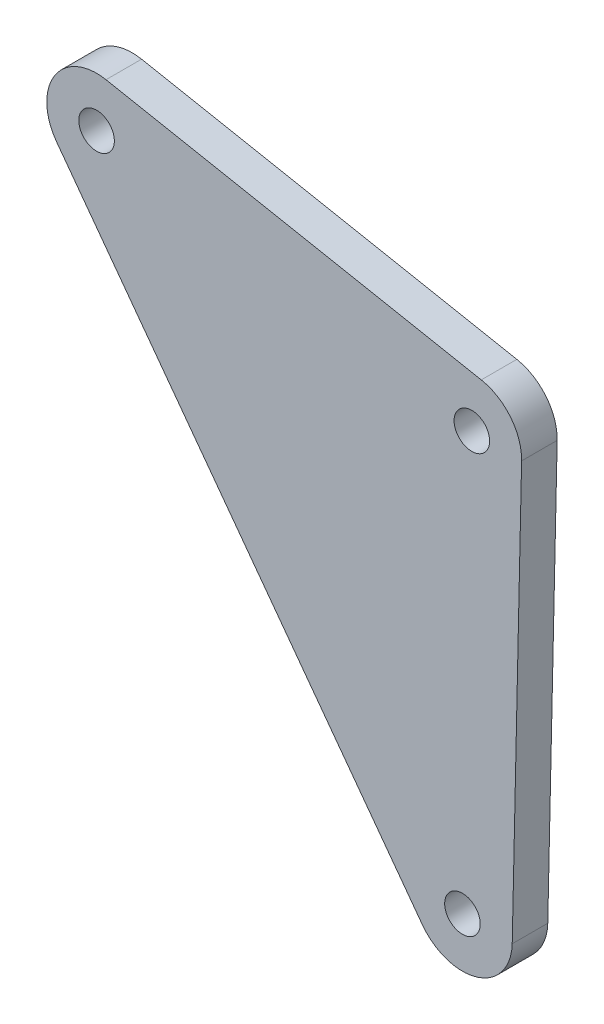
from build123d import *

# Parameters (mm, degrees)
SKETCH1_R           = 3.175
BOSS_EXTRUDE1_DEPTH = 6.35
FILLET1_R           = 8.89


with BuildPart() as part:
    # Sketch1 → Boss-Extrude1 (new body)
    with BuildSketch(Plane.XY):
        Polygon((-47.990867403, 8.485799191), (48.767729744, -10.165267976), (46.344395869, -119.203213441), align=None)
        with Locations((-27.303021427, -4.555616194)):
            Circle(SKETCH1_R, mode=Mode.SUBTRACT)
        with Locations((39.71310993, -17.473562547)):
            Circle(SKETCH1_R, mode=Mode.SUBTRACT)
        with Locations((38.034680663, -92.99451357)):
            Circle(SKETCH1_R, mode=Mode.SUBTRACT)
    extrude(amount=BOSS_EXTRUDE1_DEPTH)

    # Fillet1
    fillet1_edges = [part.edges().sort_by_distance(p)[0] for p in [
        (-47.990867403, 8.485799191, 3.175),
        (48.767729744, -10.165267976, 3.175),
        (46.344395869, -119.203213441, 3.175),
    ]]
    fillet(fillet1_edges, radius=FILLET1_R)


solid = part.part
